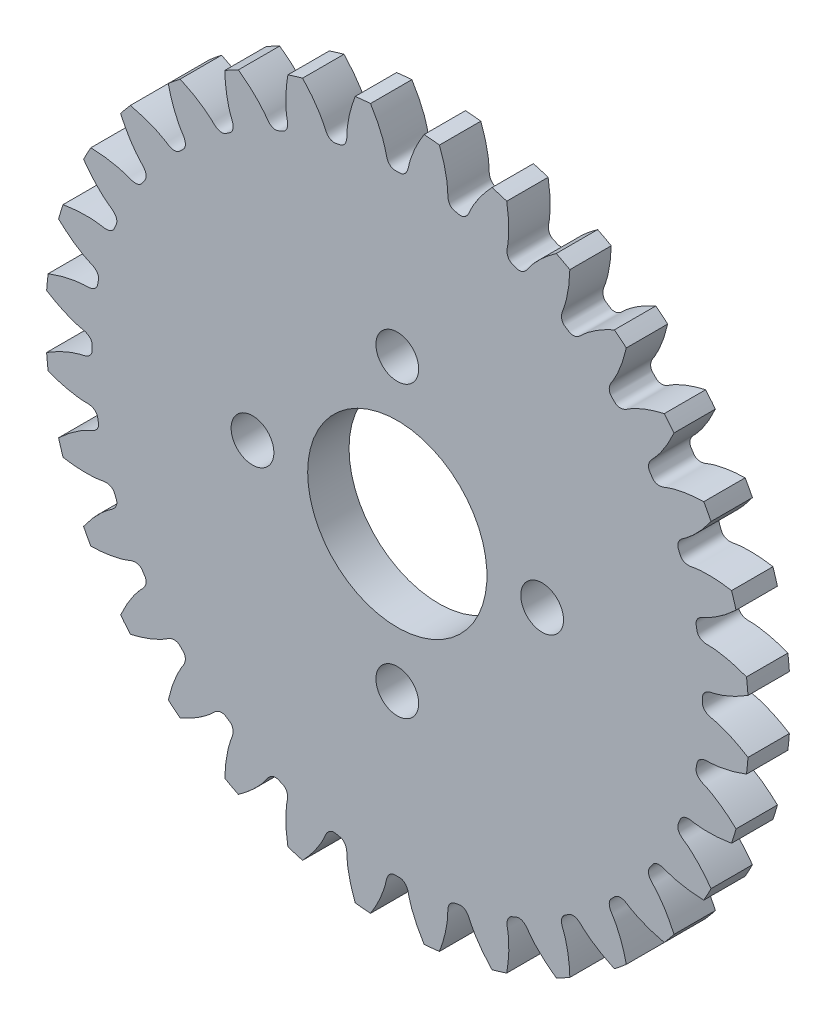
from build123d import *

# Parameters (mm, degrees)
SKETCH_339_W               = 3
SKETCH_339_H               = 25.499999617
CUT_EXTRUDE_610_DEPTH      = 10
PATTERN_CIRCULAR_664_COUNT = 32
SKETCH_1_R                 = 6.5
SKETCH_1_R_2               = 1.55
CUT_EXTRUDE_1_DEPTH        = 10


with BuildPart() as part:
    # Sketch 339 → Revolve 396 (revolve)
    with BuildSketch(Plane(origin=(0, 0, 0), x_dir=(0, 0, -1), z_dir=(1, 0, 0))):
        with Locations((-8.5, 12.749999809)):
            Rectangle(SKETCH_339_W, SKETCH_339_H)
    revolve(axis=Axis((0, 0, 0), (0, 0, -1)))

    # Sketch 442 → Cut-Extrude 610 (cut, symmetric)
    with BuildSketch(Plane.XY):
        with BuildLine():
            ThreePointArc((25.497479124, 1.989764728), (25.574999616, 0), (25.497479124, -1.989764728))
            add(Edge.make_bspline(
                [(25.497479124, -1.989764728), (25.433841386, -1.949068249), (25.349000551, -1.895927815), (25.242757985, -1.831276906), (25.180339342, -1.793837143), (25.118472751, -1.757262931), (25.057166686, -1.721545692), (24.996429526, -1.686676768), (24.936269566, -1.652647433), (24.876695013, -1.619448888), (24.817713983, -1.587072266), (24.759334503, -1.555508628), (24.701564511, -1.524748968), (24.644411854, -1.49478421), (24.587884289, -1.465605212), (24.531989479, -1.437202768), (24.476734996, -1.409567601), (24.422128321, -1.382690375), (24.368176839, -1.356561685), (24.314887844, -1.331172067), (24.262268534, -1.306511992), (24.210326012, -1.282571871), (24.159067287, -1.259342052), (24.108499274, -1.236812827), (24.058628787, -1.214974424), (24.009462548, -1.193817017), (23.96100718, -1.173330721), (23.913269208, -1.153505593), (23.86625506, -1.134331637), (23.819971065, -1.115798801), (23.774423454, -1.097896978), (23.729618359, -1.080616009), (23.685561809, -1.063945681), (23.642259737, -1.047875733), (23.599717973, -1.032395851), (23.557942247, -1.017495669), (23.516938188, -1.003164778), (23.476711322, -0.989392715), (23.437267073, -0.976168975), (23.398610765, -0.963483002), (23.360747615, -0.951324198), (23.323682741, -0.93968192), (23.287421155, -0.928545481), (23.251967765, -0.91790415), (23.217327375, -0.907747156), (23.183504686, -0.898063687), (23.150504292, -0.88884289), (23.118330683, -0.880073873), (23.086988243, -0.871745708), (23.05648125, -0.863847424), (23.026813876, -0.856368027), (22.997990189, -0.849296444), (22.970014139, -0.842621728), (22.942889607, -0.836332316), (22.916620238, -0.830418686), (22.891210021, -0.824863931), (22.823202865, -0.810495049), (22.748841772, -0.79595937), (22.670010617, -0.773488511), (22.628096093, -0.760168836), (22.587026629, -0.745506562), (22.546660709, -0.729363222), (22.506848802, -0.711504471), (22.467428212, -0.691630329), (22.428235848, -0.669339506), (22.389128372, -0.644105421), (22.350020994, -0.615245838), (22.310954032, -0.581899514), (22.272199237, -0.543026583), (22.234411528, -0.497467255), (22.198808789, -0.444113193), (22.167304961, -0.382236351), (22.142461929, -0.311997329), (22.127856027, -0.238893726), (22.121863404, -0.134033241), (22.127215021, 0), (22.121863404, 0.134033241), (22.127856027, 0.238893726), (22.142461929, 0.311997329), (22.167304961, 0.382236351), (22.198808789, 0.444113193), (22.234411528, 0.497467255), (22.272199237, 0.543026583), (22.310954032, 0.581899514), (22.350020994, 0.615245838), (22.389128372, 0.644105421), (22.428235848, 0.669339506), (22.467428212, 0.691630329), (22.506848802, 0.711504471), (22.546660709, 0.729363222), (22.587026629, 0.745506562), (22.628096093, 0.760168836), (22.670010617, 0.773488511), (22.748841772, 0.79595937), (22.823202865, 0.810495049), (22.891210021, 0.824863931), (22.916620238, 0.830418686), (22.942889607, 0.836332316), (22.970014139, 0.842621728), (22.997990189, 0.849296444), (23.026813876, 0.856368027), (23.05648125, 0.863847424), (23.086988243, 0.871745708), (23.118330683, 0.880073873), (23.150504292, 0.88884289), (23.183504686, 0.898063687), (23.217327375, 0.907747156), (23.251967765, 0.91790415), (23.287421155, 0.928545481), (23.323682741, 0.93968192), (23.360747615, 0.951324198), (23.398610765, 0.963483002), (23.437267073, 0.976168975), (23.476711322, 0.989392715), (23.516938188, 1.003164778), (23.557942247, 1.017495669), (23.599717973, 1.032395851), (23.642259737, 1.047875733), (23.685561809, 1.063945681), (23.729618359, 1.080616009), (23.774423454, 1.097896978), (23.819971065, 1.115798801), (23.86625506, 1.134331637), (23.913269208, 1.153505593), (23.96100718, 1.173330721), (24.009462548, 1.193817017), (24.058628787, 1.214974424), (24.108499274, 1.236812827), (24.159067287, 1.259342052), (24.210326012, 1.282571871), (24.262268534, 1.306511992), (24.314887844, 1.331172067), (24.368176839, 1.356561685), (24.422128321, 1.382690375), (24.476734996, 1.409567601), (24.531989479, 1.437202768), (24.587884289, 1.465605212), (24.644411854, 1.49478421), (24.701564511, 1.524748968), (24.759334503, 1.555508628), (24.817713983, 1.587072266), (24.876695013, 1.619448888), (24.936269566, 1.652647433), (24.996429526, 1.686676768), (25.057166686, 1.721545692), (25.118472751, 1.757262931), (25.180339342, 1.793837143), (25.242757985, 1.831276906), (25.349000551, 1.895927815), (25.433841386, 1.949068249), (25.497479124, 1.989764728)],
                knots=[0, 0, 0, 0, 0.027363993, 0.03626385, 0.045052955, 0.053731308, 0.062298909, 0.070755757, 0.079101854, 0.087337198, 0.095461789, 0.103475628, 0.111378716, 0.11917105, 0.126852633, 0.134423463, 0.141883541, 0.149232867, 0.15647144, 0.163599262, 0.170616331, 0.177522647, 0.184318212, 0.191003024, 0.197577084, 0.204040391, 0.210392947, 0.21663475, 0.222765801, 0.228786099, 0.234695645, 0.240494439, 0.246182481, 0.251759771, 0.257226308, 0.262582093, 0.267827125, 0.272961406, 0.277984934, 0.28289771, 0.287699733, 0.292391005, 0.296971524, 0.301441291, 0.305800305, 0.310048568, 0.314186078, 0.318212835, 0.322128841, 0.325934094, 0.329628595, 0.333212344, 0.33668534, 0.340047584, 0.343299076, 0.346439816, 0.349469803, 0.368480879, 0.37385384, 0.379155902, 0.384410925, 0.389647674, 0.394900934, 0.400212842, 0.405634381, 0.411226906, 0.417063356, 0.423228421, 0.429816332, 0.436924065, 0.444637077, 0.453005409, 0.462012118, 0.471544897, 0.479900251, 0.5, 0.520099749, 0.528455103, 0.537987882, 0.546994591, 0.555362923, 0.563075935, 0.570183668, 0.576771579, 0.582936644, 0.588773094, 0.594365619, 0.599787158, 0.605099066, 0.610352326, 0.615589075, 0.620844098, 0.62614616, 0.631519121, 0.650530197, 0.653560184, 0.656700924, 0.659952416, 0.66331466, 0.666787656, 0.670371405, 0.674065906, 0.677871159, 0.681787165, 0.685813922, 0.689951432, 0.694199695, 0.698558709, 0.703028476, 0.707608995, 0.712300267, 0.71710229, 0.722015066, 0.727038594, 0.732172875, 0.737417907, 0.742773692, 0.748240229, 0.753817519, 0.759505561, 0.765304355, 0.771213901, 0.777234199, 0.78336525, 0.789607053, 0.795959609, 0.802422916, 0.808996976, 0.815681788, 0.822477353, 0.829383669, 0.836400738, 0.84352856, 0.850767133, 0.858116459, 0.865576537, 0.873147367, 0.88082895, 0.888621284, 0.896524372, 0.904538211, 0.912662802, 0.920898146, 0.929244243, 0.937701091, 0.946268692, 0.954947045, 0.96373615, 0.972636007, 1, 1, 1, 1], degree=3))
        make_face()
    cut_extrude_610 = extrude(amount=CUT_EXTRUDE_610_DEPTH, both=True, mode=Mode.SUBTRACT)

    # Pattern Circular 664: Cut-Extrude 610 ×32 about axis
    pattern_circular_664_axis = Axis((0, 0, 55), (0, 0, -1))
    for i in range(1, PATTERN_CIRCULAR_664_COUNT):
        add(cut_extrude_610.rotate(pattern_circular_664_axis, i * 360 / PATTERN_CIRCULAR_664_COUNT), mode=Mode.SUBTRACT)

    # 草图1 → 切除-拉伸1 (cut)
    with BuildSketch(Plane(origin=(0, 0, 7), x_dir=(-1, 0, 0), z_dir=(0, 0, -1))):
        Circle(SKETCH_1_R)
        with Locations((0, 10.5)):
            Circle(SKETCH_1_R_2)
        with Locations((10.5, 0)):
            Circle(SKETCH_1_R_2)
        with Locations((0, -10.5)):
            Circle(SKETCH_1_R_2)
        with Locations((-10.5, 0)):
            Circle(SKETCH_1_R_2)
    extrude(amount=-CUT_EXTRUDE_1_DEPTH, mode=Mode.SUBTRACT)


solid = part.part
